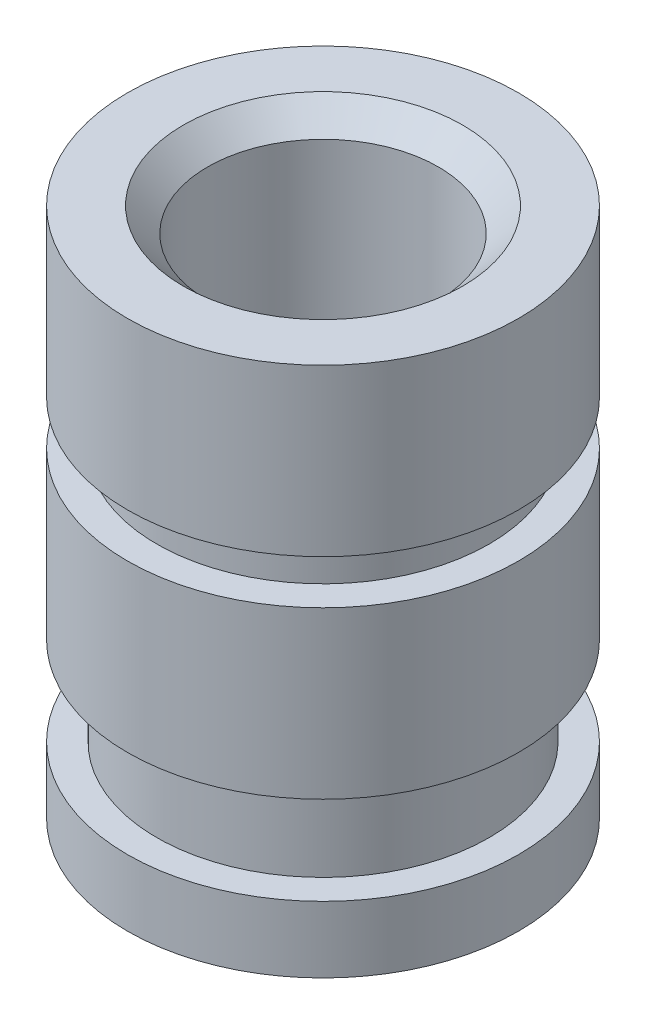
from build123d import *

# Parameters (mm, degrees)
CUT_EXTRUDE1_REACH = 12.713
SKETCH3_R          = 2.067


with BuildPart() as part:
    # Sketch2 → Revolve1 (revolve)
    with BuildSketch(Plane.XY):
        Polygon((0, 0), (3.5, 0), (3.5, 1.188), (2.975, 1.188), (2.975, 2.771), (3.5, 2.771), (3.5, 5.74), (2.975, 5.74), (2.975, 6.532), (3.5, 6.532), (3.5, 9.501), (0, 9.501), align=None)
    revolve(axis=Axis((0, -157.439431358, 0), (0, 1, 0)))

    # Sketch3 → Cut-Extrude1 (cut, up to next)
    with BuildSketch(Plane(origin=(0, 9.501, 0), x_dir=(1, 0, 0), z_dir=(0, 1, 0)), mode=Mode.PRIVATE) as cut_extrude1_sk1:
        with Locations(Location((0, 0, 0), (0, 0, 180))):
            Circle(SKETCH3_R)
    cut_extrude1_tool1 = extrude(cut_extrude1_sk1.sketch, amount=-CUT_EXTRUDE1_REACH, mode=Mode.PRIVATE) & part.part
    add(cut_extrude1_tool1.solids().sort_by_distance((0, 9.501, 0))[0], mode=Mode.SUBTRACT)

    # Sketch14 → Cut-Revolve1 (revolve, cut)
    with BuildSketch(Plane.XY, mode=Mode.PRIVATE) as cut_revolve1_sk:
        Polygon((-2.5, 9.501), (-2.067, 9.068), (-2.067, 9.501), align=None)
        Polygon((-2.5, 0), (-2.067, 0.433), (-2.067, 0), align=None)
    revolve(cut_revolve1_sk.sketch.rotate(Axis((0, -1000, 0), (0, 1, 0)), 180), axis=Axis((0, -1000, 0), (0, 1, 0)), mode=Mode.SUBTRACT)


solid = part.part
